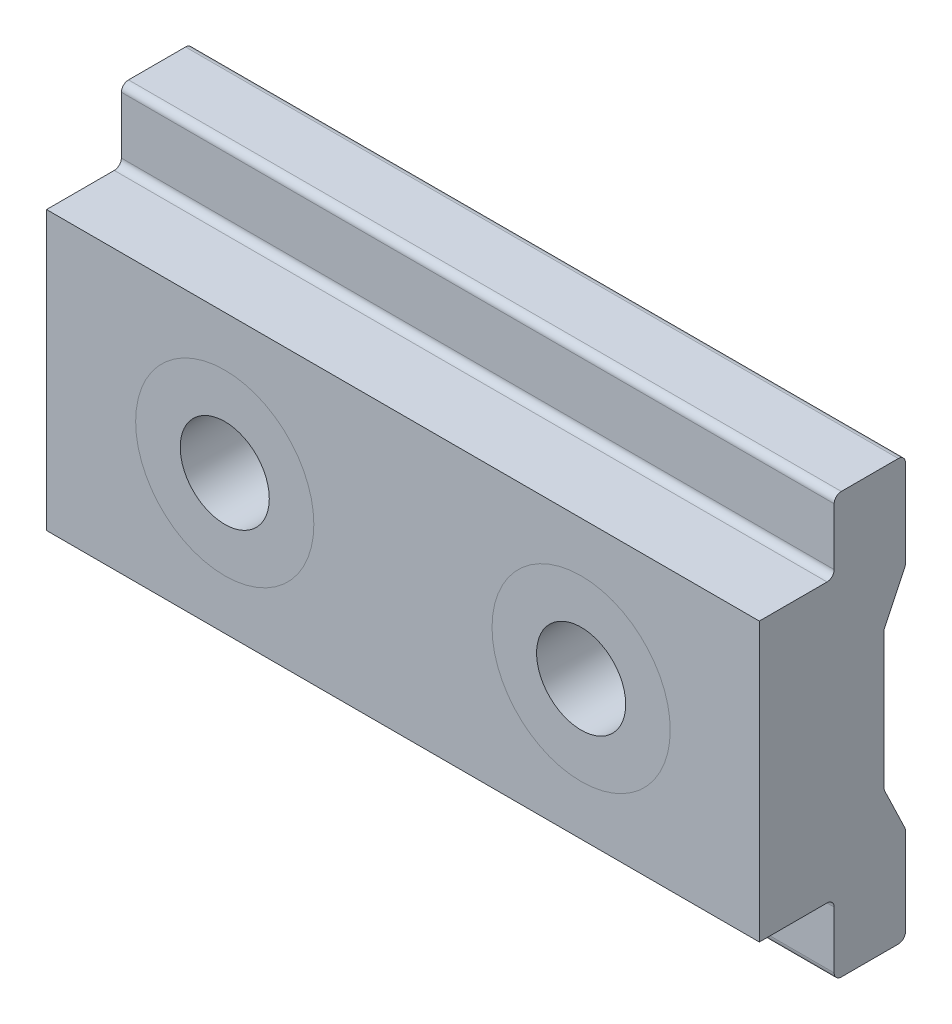
from build123d import *

# Parameters (mm, degrees)
EXTRUDE_1_DEPTH             = 10
FILLET_1_R                  = 0.2
SKETCH_4_R                  = 2.5
CUT_EXTRUDE_1_DEPTH         = 13.313407327
SKETCH_5_R                  = 2.5
EXTRUDE_2_DEPTH             = 3.5
EXTRUDE_2_2_DEPTH           = 3.5
SKETCH_3_W                  = 1.25
SKETCH_3_H                  = 4.1
HOLE_WIZARD_M3_1_AT_2_COUNT = 2
HOLE_WIZARD_M3_1_AT_2_PITCH = 10


with BuildPart() as part:
    # 草图1 → 凸台-拉伸1 (new, symmetric)
    with BuildSketch(Plane(origin=(0, 0, 0), x_dir=(0, 0, -1), z_dir=(1, 0, 0))):
        Polygon((-7, 3.9), (-7, -3.9), (-4.9, -3.9), (-4.9, -5.9), (-2.9, -5.9), (-2.9, -3.2), (-3.5, -1.95), (-3.5, 1.95), (-2.9, 3.2), (-2.9, 5.9), (-4.9, 5.9), (-4.9, 3.9), align=None)
    extrude(amount=EXTRUDE_1_DEPTH, both=True)

    # 圆角1
    fillet_1_edges = [part.edges().sort_by_distance(p)[0] for p in [
        (0, 3.9, 4.9),
        (0, 5.9, 4.9),
        (0, 5.9, 2.9),
        (0, 3.2, 2.9),
        (0, 1.95, 3.5),
        (0, -1.95, 3.5),
        (0, -3.2, 2.9),
        (0, -5.9, 2.9),
        (0, -5.9, 4.9),
        (0, -3.9, 4.9),
    ]]
    fillet(fillet_1_edges, radius=FILLET_1_R)

    # 草图4 → 切除-拉伸1 (cut, through all)
    with BuildSketch(Plane.XY.offset(7)):
        with Locations((-5, 0)):
            Circle(SKETCH_4_R)
        with Locations((5, 0)):
            Circle(SKETCH_4_R)
    extrude(amount=-CUT_EXTRUDE_1_DEPTH, mode=Mode.SUBTRACT)


with BuildPart() as body_2:
    # 草图5 → 凸台-拉伸2 (new body)
    with BuildSketch(Plane.XY.offset(7)):
        with Locations((5, 0)):
            Circle(SKETCH_5_R)
    extrude(amount=-EXTRUDE_2_DEPTH)


with BuildPart() as body_3:
    # 草图5 → Extrude 2 2 (new body)
    with BuildSketch(Plane.XY.offset(7)):
        with Locations((-5, 0)):
            Circle(SKETCH_5_R)
    extrude(amount=-EXTRUDE_2_2_DEPTH)

    # 草图3 → M3 螺纹孔1 (revolve, cut)
    with BuildSketch(Plane(origin=(-5, 0, 7), x_dir=(0, -1, 0), z_dir=(1, 0, 0))):
        with Locations((0.625, 2.05)):
            Rectangle(SKETCH_3_W, SKETCH_3_H)
    hole_wizard_m3_1 = revolve(axis=Axis((-5, 0, 13.35), (0, 0, -1)), mode=Mode.SUBTRACT)


with BuildPart() as body_2_1:
    add(body_2.part)

    # M3 螺纹孔1 at 2: M3 螺纹孔1 ×2
    with Locations(*[(i * HOLE_WIZARD_M3_1_AT_2_PITCH, 0, 0) for i in range(1, HOLE_WIZARD_M3_1_AT_2_COUNT)]):
        add(hole_wizard_m3_1, mode=Mode.SUBTRACT)


solid = Compound([part.part, body_3.part, body_2_1.part])
